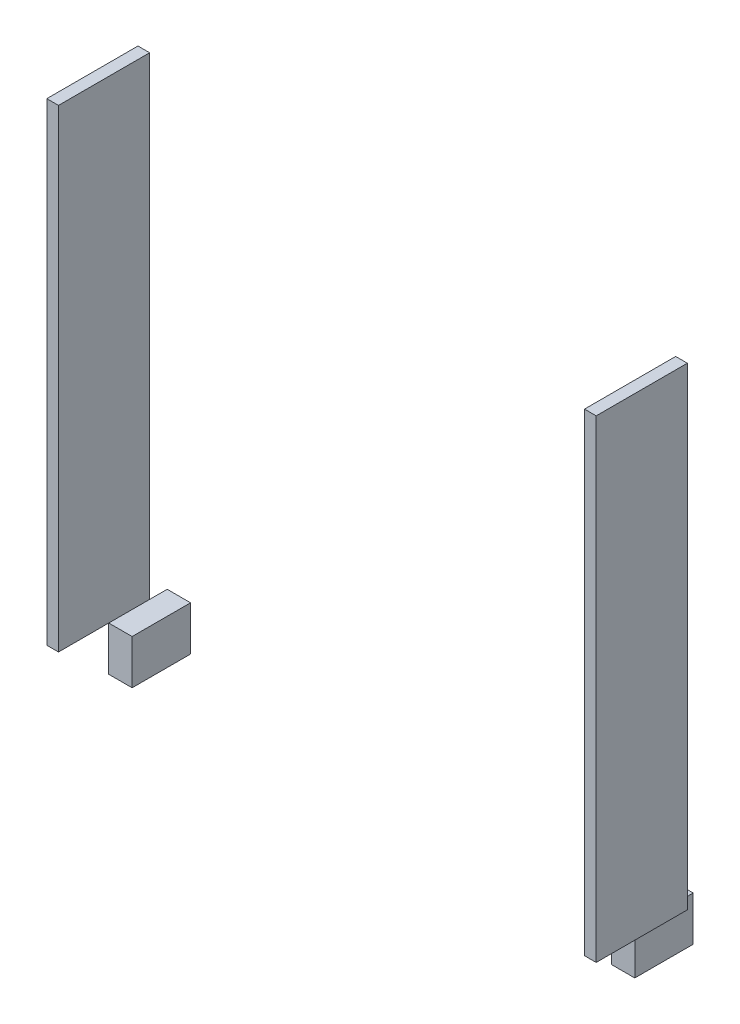
from build123d import *

# Parameters (mm, degrees)
WALL_MOUNT_RAIL_ASSUMED_START = 300
SKETCH1_W                     = 10
SKETCH1_H                     = 405
WALL_MOUNT_RAIL_ASSUMED_DEPTH = 78
BOSS_EXTRUDE2_START           = 300
SKETCH2_W                     = 10
SKETCH2_H                     = 405
BOSS_EXTRUDE2_DEPTH           = 78
RADIATOR_FOOT_ASSUMED_START   = 285
SKETCH3_W                     = 20
SKETCH3_H                     = 38
RADIATOR_FOOT_ASSUMED_DEPTH   = 50
BOSS_EXTRUDE4_START           = 285
SKETCH4_W                     = 20
SKETCH4_H                     = 38
BOSS_EXTRUDE4_DEPTH           = 50


with BuildPart() as part:
    # Sketch1 → Wall_mount_rail_ASSUMED (new body)
    with BuildSketch(Plane.XY.offset(WALL_MOUNT_RAIL_ASSUMED_START)):
        with Locations((-230, 242.5)):
            Rectangle(SKETCH1_W, SKETCH1_H)
    extrude(amount=WALL_MOUNT_RAIL_ASSUMED_DEPTH)


with BuildPart() as body_2:
    # Sketch2 → Boss-Extrude2 (new body)
    with BuildSketch(Plane.XY.offset(BOSS_EXTRUDE2_START)):
        with Locations((230, 242.5)):
            Rectangle(SKETCH2_W, SKETCH2_H)
    extrude(amount=BOSS_EXTRUDE2_DEPTH)


with BuildPart() as body_3:
    # Sketch3 → Radiator_foot_ASSUMED (new body)
    with BuildSketch(Plane.XY.offset(RADIATOR_FOOT_ASSUMED_START)):
        with Locations((-215, 21)):
            Rectangle(SKETCH3_W, SKETCH3_H)
    extrude(amount=RADIATOR_FOOT_ASSUMED_DEPTH)


with BuildPart() as body_4:
    # Sketch4 → Boss-Extrude4 (new body)
    with BuildSketch(Plane.XY.offset(BOSS_EXTRUDE4_START)):
        with Locations((215, 21)):
            Rectangle(SKETCH4_W, SKETCH4_H)
    extrude(amount=BOSS_EXTRUDE4_DEPTH)


solid = Compound([part.part, body_2.part, body_3.part, body_4.part])
